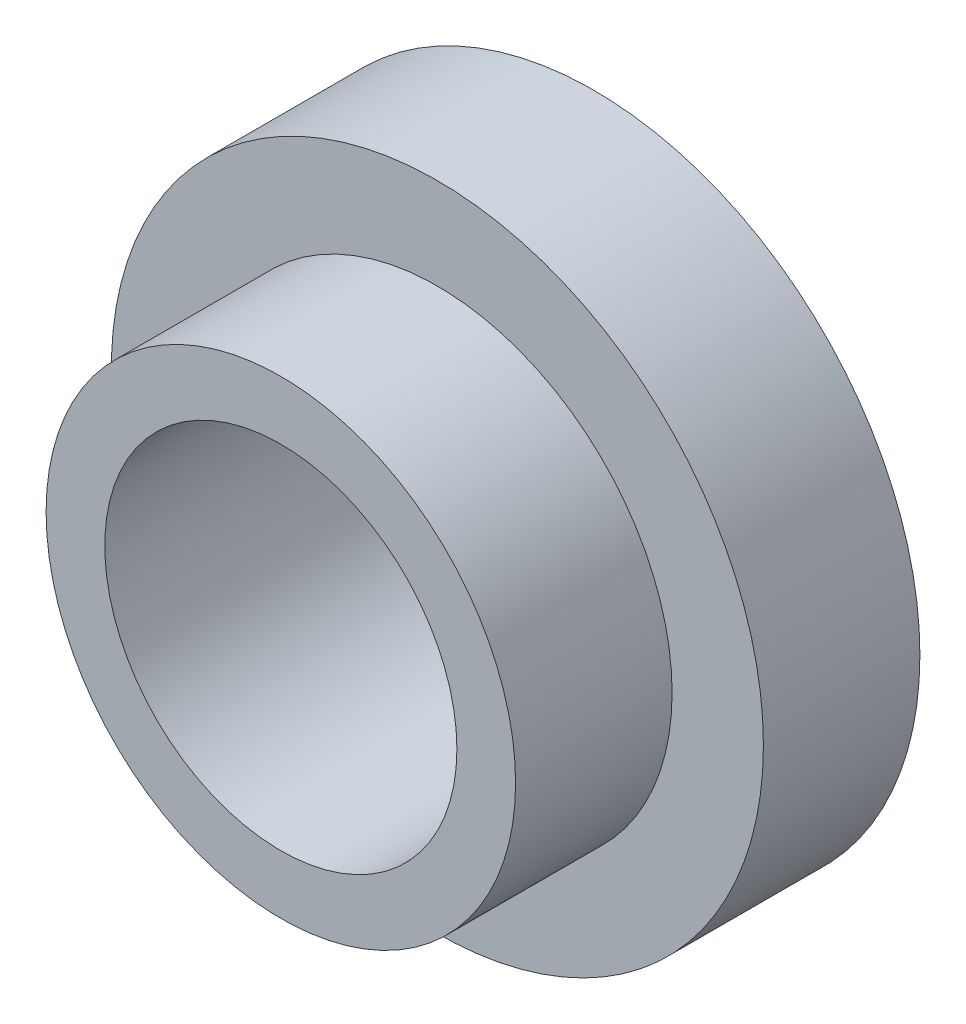
from build123d import *

# Parameters (mm, degrees)
SKETCH1_R           = 25
SKETCH1_R_2         = 5.5
SKETCH1_R_3         = 1.55
BOSS_EXTRUDE1_DEPTH = 4
SKETCH2_R           = 2.8
CUT_EXTRUDE1_DEPTH  = 2.8
SKETCH4_R           = 18
SKETCH4_R_2         = 13.5
BOSS_EXTRUDE2_DEPTH = 20
SKETCH5_R           = 25
SKETCH5_R_2         = 18
BOSS_EXTRUDE3_DEPTH = 8
SKETCH3_R           = 2.5
CUT_EXTRUDE3_DEPTH  = 8


with BuildPart() as part:
    # Sketch1 → Boss-Extrude1 (new body)
    with BuildSketch(Plane.XY):
        Circle(SKETCH1_R)
        Circle(SKETCH1_R_2, mode=Mode.SUBTRACT)
        with Locations((0, 11)):
            Circle(SKETCH1_R_3, mode=Mode.SUBTRACT)
        with Locations((9.526279442, 5.5)):
            Circle(SKETCH1_R_3, mode=Mode.SUBTRACT)
        with Locations((9.526279442, -5.5)):
            Circle(SKETCH1_R_3, mode=Mode.SUBTRACT)
        with Locations((0, -11)):
            Circle(SKETCH1_R_3, mode=Mode.SUBTRACT)
        with Locations((-9.526279442, -5.5)):
            Circle(SKETCH1_R_3, mode=Mode.SUBTRACT)
        with Locations((-9.526279442, 5.5)):
            Circle(SKETCH1_R_3, mode=Mode.SUBTRACT)
    extrude(amount=BOSS_EXTRUDE1_DEPTH)

    # Sketch2 → Cut-Extrude1 (cut)
    with BuildSketch(Plane(origin=(0, 0, 0), x_dir=(-1, 0, 0), z_dir=(0, 0, -1))):
        with Locations((0, 11)):
            Circle(SKETCH2_R)
        with Locations((9.526279442, 5.5)):
            Circle(SKETCH2_R)
        with Locations((9.526279442, -5.5)):
            Circle(SKETCH2_R)
        with Locations((0, -11)):
            Circle(SKETCH2_R)
        with Locations((-9.526279442, -5.5)):
            Circle(SKETCH2_R)
        with Locations((-9.526279442, 5.5)):
            Circle(SKETCH2_R)
    extrude(amount=-CUT_EXTRUDE1_DEPTH, mode=Mode.SUBTRACT)

    # Sketch4 → Boss-Extrude2 (add)
    with BuildSketch(Plane.XY.offset(4)):
        Circle(SKETCH4_R)
        Circle(SKETCH4_R_2, mode=Mode.SUBTRACT)
    extrude(amount=BOSS_EXTRUDE2_DEPTH)

    # Sketch5 → Boss-Extrude3 (add)
    with BuildSketch(Plane.XY.offset(4)):
        Circle(SKETCH5_R)
        Circle(SKETCH5_R_2, mode=Mode.SUBTRACT)
    extrude(amount=BOSS_EXTRUDE3_DEPTH)

    # Sketch3 → Cut-Extrude3 (cut)
    with BuildSketch(Plane(origin=(0, 0, 0), x_dir=(-1, 0, 0), z_dir=(0, 0, -1))):
        with Locations((0, 18)):
            Circle(SKETCH3_R)
        with Locations((18, 0)):
            Circle(SKETCH3_R)
        with Locations((0, -18)):
            Circle(SKETCH3_R)
        with Locations((-18, 0)):
            Circle(SKETCH3_R)
    extrude(amount=-CUT_EXTRUDE3_DEPTH, mode=Mode.SUBTRACT)


solid = part.part
